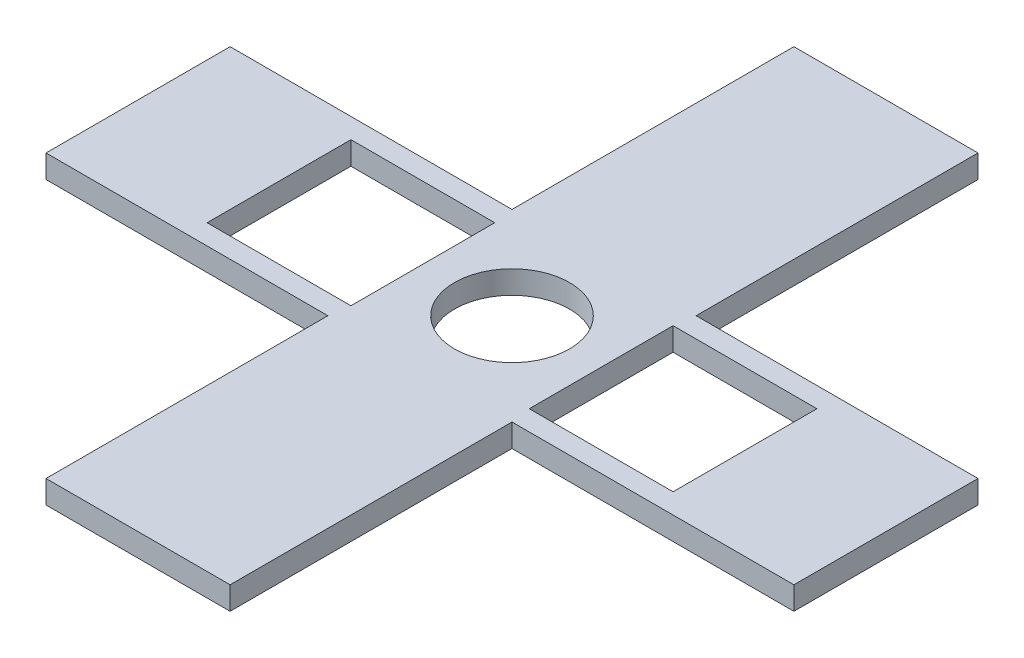
from build123d import *

# Parameters (mm, degrees)
SKETCH1_R           = 3.175
SKETCH1_W           = 7.9375
SKETCH1_H           = 7.9375
BOSS_EXTRUDE1_DEPTH = 1.27


with BuildPart() as part:
    # Sketch1 → Boss-Extrude1 (new body)
    with BuildSketch(Plane(origin=(0, 0, 0), x_dir=(1, 0, 0), z_dir=(0, 1, 0))):
        Polygon((-20.6375, 5.08), (-5.08, 5.08), (-5.08, 20.6375), (5.08, 20.6375), (5.08, 5.08), (20.6375, 5.08), (20.6375, -5.08), (5.08, -5.08), (5.08, -20.6375), (-5.08, -20.6375), (-5.08, -5.08), (-20.6375, -5.08), align=None)
        with Locations(Location((0, 0, 0), (0, 0, 270))):
            Circle(SKETCH1_R, mode=Mode.SUBTRACT)
        with Locations((8.89, 0)):
            Rectangle(SKETCH1_W, SKETCH1_H, mode=Mode.SUBTRACT)
        with Locations((-8.89, 0)):
            Rectangle(SKETCH1_W, SKETCH1_H, mode=Mode.SUBTRACT)
    extrude(amount=BOSS_EXTRUDE1_DEPTH)


solid = part.part
